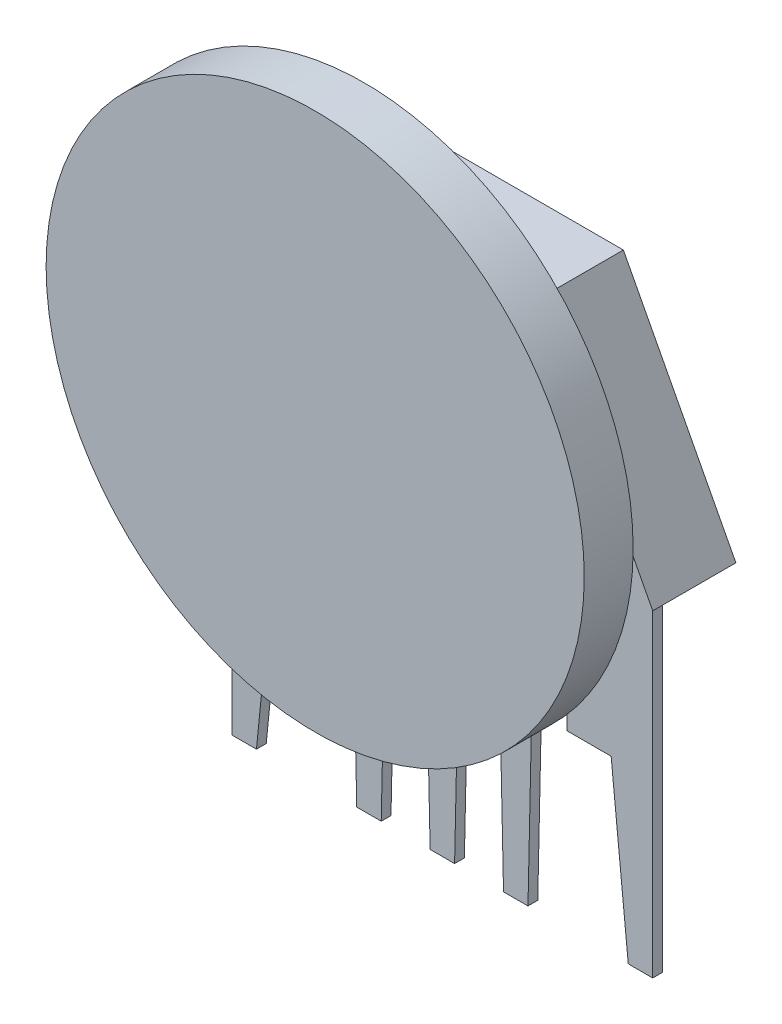
from build123d import *

# Parameters (mm, degrees)
SKETCH1_R           = 11
BOSS_EXTRUDE1_DEPTH = 2
SKETCH2_R           = 7
BOSS_EXTRUDE2_DEPTH = 2.2
SKETCH3_R           = 5.5
BOSS_EXTRUDE3_DEPTH = 1
BOSS_EXTRUDE4_DEPTH = 0.4
BOSS_EXTRUDE5_DEPTH = 3


with BuildPart() as part:
    # Sketch1 → Boss-Extrude1 (new body)
    with BuildSketch(Plane.XY):
        Circle(SKETCH1_R)
    extrude(amount=BOSS_EXTRUDE1_DEPTH)

    # Sketch2 → Boss-Extrude2 (add)
    with BuildSketch(Plane(origin=(0, 0, 0), x_dir=(-1, 0, 0), z_dir=(0, 0, -1))):
        with Locations(Location((0, 0, 0), (0, 0, 180))):
            Circle(SKETCH2_R)
    extrude(amount=BOSS_EXTRUDE2_DEPTH)

    # Sketch3 → Boss-Extrude3 (add)
    with BuildSketch(Plane(origin=(0, 0, -2.2), x_dir=(-1, 0, 0), z_dir=(0, 0, -1))):
        Circle(SKETCH3_R)
    extrude(amount=BOSS_EXTRUDE3_DEPTH)

    # Sketch4 → Boss-Extrude4 (add)
    with BuildSketch(Plane(origin=(0, 0, -3.2), x_dir=(-1, 0, 0), z_dir=(0, 0, -1))):
        Polygon((-4, 3.774917218), (4, 3.774917218), (8.6, -5), (8.6, -18), (7.6, -18), (6.9, -11), (5.1, -11), (5.1, -2.059126028), (3.85, -2.059126028), (3.5, -18), (2.5, -18), (2.15, -2.059126028), (0.85, -2.059126028), (0.5, -18), (-0.5, -18), (-0.85, -2.059126028), (-2.15, -2.059126028), (-2.5, -18), (-3.5, -18), (-3.85, -2.059126028), (-5.1, -2.059126028), (-5.1, -11), (-6.9, -11), (-7.6, -18), (-8.6, -18), (-8.6, -5), align=None)
    extrude(amount=BOSS_EXTRUDE4_DEPTH)

    # Sketch5 → Boss-Extrude5 (add)
    with BuildSketch(Plane(origin=(0, 0, -3.6), x_dir=(-1, 0, 0), z_dir=(0, 0, -1))):
        Polygon((-8.6, -5), (-4, 3.774917218), (4, 3.774917218), (8.6, -5), align=None)
    extrude(amount=BOSS_EXTRUDE5_DEPTH)


solid = part.part
